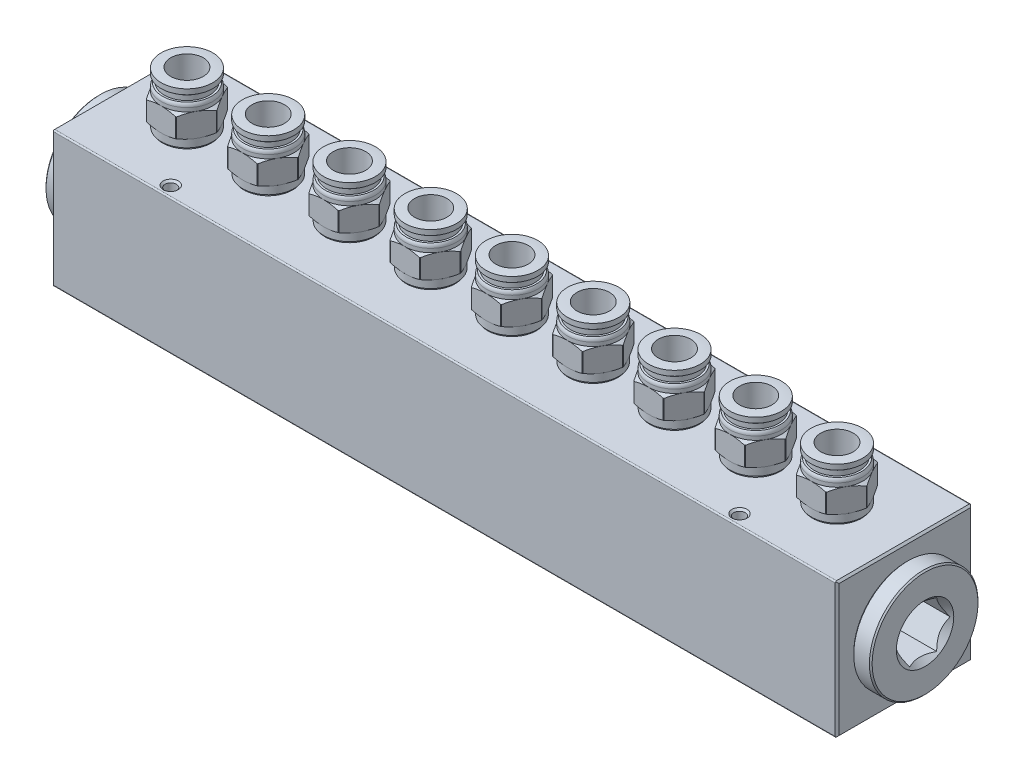
from build123d import *

# Parameters (mm, degrees)
SKETCH_1_W             = 50
SKETCH_1_H             = 50
SKETCH_1_R             = 16
EXTRUDE_1_DEPTH        = 145
SKETCH_2_R             = 7.6
CUT_EXTRUDE_1_DEPTH    = 20
SKETCH_3_R             = 2.1
CUT_EXTRUDE_2_DEPTH    = 156.402702773
CHAMFER_1_SIZE         = 0.7
FILLET_1_R             = 0.5
CUT_EXTRUDE_3_DEPTH    = 15.6
CHAMFER_2_SIZE         = 0.5
SKETCH_12_R            = 12
CUT_EXTRUDE_6_DEPTH    = 15
PATTERN_LINEAR_1_COUNT = 9
PATTERN_LINEAR_1_PITCH = 30


with BuildPart() as part:
    # 草圖1 → 填料-伸長1 (new, symmetric)
    with BuildSketch(Plane(origin=(0, 0, 0), x_dir=(0, 0, -1), z_dir=(1, 0, 0))):
        Rectangle(SKETCH_1_W, SKETCH_1_H)
        Circle(SKETCH_1_R, mode=Mode.SUBTRACT)
    extrude(amount=EXTRUDE_1_DEPTH, both=True)

    # 草圖2 → 除料-伸長1 (cut)
    with BuildSketch(Plane(origin=(0, 25, 0), x_dir=(1, 0, 0), z_dir=(0, 1, 0))):
        with Locations((120, 0)):
            Circle(SKETCH_2_R)
        with Locations((90, 0)):
            Circle(SKETCH_2_R)
        with Locations((60, 0)):
            Circle(SKETCH_2_R)
        with Locations((30, 0)):
            Circle(SKETCH_2_R)
        Circle(SKETCH_2_R)
        with Locations((-30, 0)):
            Circle(SKETCH_2_R)
        with Locations((-60, 0)):
            Circle(SKETCH_2_R)
        with Locations((-90, 0)):
            Circle(SKETCH_2_R)
        with Locations((-120, 0)):
            Circle(SKETCH_2_R)
    extrude(amount=-CUT_EXTRUDE_1_DEPTH, mode=Mode.SUBTRACT)

    # 草圖3 → 除料-伸長2 (cut, through all)
    with BuildSketch(Plane(origin=(0, 25, 0), x_dir=(1, 0, 0), z_dir=(0, 1, 0))):
        with Locations((105, 21)):
            Circle(SKETCH_3_R)
        with Locations((105, -21)):
            Circle(SKETCH_3_R)
        with Locations((-105, -21)):
            Circle(SKETCH_3_R)
        with Locations((-105, 21)):
            Circle(SKETCH_3_R)
    extrude(amount=-CUT_EXTRUDE_2_DEPTH, mode=Mode.SUBTRACT)

    # 導角1
    chamfer_1_edges = [part.edges().sort_by_distance(p)[0] for p in [
        (102.9, -25, -21),
        (102.9, -25, 21),
        (-107.1, -25, -21),
        (-107.1, -25, 21),
        (102.9, 25, -21),
        (102.9, 25, 21),
        (-107.1, 25, -21),
        (-107.1, 25, 21),
        (-145, 25, 0),
        (-145, 0, -25),
        (-145, -25, 0),
        (-145, 0, 25),
        (145, 0, -25),
        (145, -25, 0),
        (145, 0, 25),
        (145, 25, 0),
    ]]
    chamfer(chamfer_1_edges, length=CHAMFER_1_SIZE)

    # 圓角1
    fillet_1_edges = [part.edges().sort_by_distance(p)[0] for p in [
        (0, -25, -25),
        (0, -25, 25),
        (0, 25, -25),
        (0, 25, 25),
    ]]
    fillet(fillet_1_edges, radius=FILLET_1_R)


with BuildPart() as body_2:
    # 草圖4 → 旋轉1 (revolve)
    with BuildSketch(Plane(origin=(0, 0, 0), x_dir=(1, 0, 0), z_dir=(0, 1, 0))):
        Polygon((-133, 0), (-133, 16), (-145, 16), (-145, 18.55), (-145.7, 18.55), (-145.7, 20.05), (-152.5, 20.05), (-152.5, 10.6), (-148.5, 6.6), (-148.5, 0), align=None)
    revolve(axis=Axis((-123.427630141, 0, 0), (-1, 0, 0)))

    # 草圖5 → 除料-伸長3 (cut)
    with BuildSketch(Plane.ZY.offset(152.5)):
        Polygon((9.93042463, 0), (4.965212315, 8.6), (-4.965212315, 8.6), (-9.93042463, 0), (-4.965212315, -8.6), (4.965212315, -8.6), align=None)
    extrude(amount=-CUT_EXTRUDE_3_DEPTH, mode=Mode.SUBTRACT)

    # 導角2
    chamfer_2_edges = [body_2.edges().sort_by_distance(p)[0] for p in [
        (-145.7, 0, 20.05),
        (-152.5, 0, 20.05),
    ]]
    chamfer(chamfer_2_edges, length=CHAMFER_2_SIZE)


with BuildPart() as body_3:
    # 鏡射2: mirrored copy
    add(body_2.part.mirror(Plane(origin=(0, 0, 0), x_dir=(0, 0, 1), z_dir=(1, 0, 0))))


with BuildPart() as body_4:
    # 草圖11 → 旋轉4 (revolve)
    with BuildSketch(Plane.XY):
        with BuildLine():
            Line((127.6, 18.8), (127.6, 25))
            Line((127.6, 25), (129, 25))
            Line((129, 25), (129, 25.7))
            Line((129, 25.7), (129.5, 25.7))
            Line((129.5, 25.7), (129.5, 28.5))
            Line((129.5, 28.5), (130.95, 29.33715789))
            Line((130.95, 29.33715789), (130.95, 36.391709623))
            Line((130.95, 36.391709623), (129.55, 37.2))
            Line((129.55, 37.2), (129.55, 38.6))
            ThreePointArc((129.55, 38.6), (129.421249625, 39.343303437), (129.05, 40))
            Line((129.05, 40), (128.35, 40))
            Line((128.35, 40), (128.35, 41.8))
            Line((128.35, 41.8), (126.55, 41.8))
            Line((126.55, 41.8), (126.55, 42.7))
            Line((126.55, 42.7), (129.55, 42.7))
            Line((129.55, 42.7), (129.55, 44.6))
            ThreePointArc((129.55, 44.6), (127.77781467, 44.749960388), (126, 44.8))
            Line((126, 44.8), (126, 18.8))
            Line((126, 18.8), (127.6, 18.8))
        make_face()
    revolve(axis=Axis((120, 25, 0), (0, 1, 0)))

    # 草圖12 → 除料-伸長6 (cut)
    with BuildSketch(Plane(origin=(0, 25, 0), x_dir=(1, 0, 0), z_dir=(0, 1, 0))):
        with Locations((120, 0)):
            Circle(SKETCH_12_R)
        Polygon((131.027390142, 0), (125.513695071, 9.55), (114.486304929, 9.55), (108.972609858, 0), (114.486304929, -9.55), (125.513695071, -9.55), align=None, mode=Mode.SUBTRACT)
    extrude(amount=CUT_EXTRUDE_6_DEPTH, mode=Mode.SUBTRACT)


with BuildPart() as pattern_linear_1_1:
    # 直線複製排列1: pattern copy
    add(body_4.part.moved(Location(Vector(-1, 0, 0) * (1 * PATTERN_LINEAR_1_PITCH))))


with BuildPart() as pattern_linear_1_2:
    # 直線複製排列1: pattern copy
    add(body_4.part.moved(Location(Vector(-1, 0, 0) * (2 * PATTERN_LINEAR_1_PITCH))))


with BuildPart() as pattern_linear_1_3:
    # 直線複製排列1: pattern copy
    add(body_4.part.moved(Location(Vector(-1, 0, 0) * (3 * PATTERN_LINEAR_1_PITCH))))


with BuildPart() as pattern_linear_1_4:
    # 直線複製排列1: pattern copy
    add(body_4.part.moved(Location(Vector(-1, 0, 0) * (4 * PATTERN_LINEAR_1_PITCH))))


with BuildPart() as pattern_linear_1_5:
    # 直線複製排列1: pattern copy
    add(body_4.part.moved(Location(Vector(-1, 0, 0) * (5 * PATTERN_LINEAR_1_PITCH))))


with BuildPart() as pattern_linear_1_6:
    # 直線複製排列1: pattern copy
    add(body_4.part.moved(Location(Vector(-1, 0, 0) * (6 * PATTERN_LINEAR_1_PITCH))))


with BuildPart() as pattern_linear_1_7:
    # 直線複製排列1: pattern copy
    add(body_4.part.moved(Location(Vector(-1, 0, 0) * (7 * PATTERN_LINEAR_1_PITCH))))


with BuildPart() as pattern_linear_1_8:
    # 直線複製排列1: pattern copy
    add(body_4.part.moved(Location(Vector(-1, 0, 0) * (8 * PATTERN_LINEAR_1_PITCH))))


solid = Compound([part.part, body_2.part, body_3.part, body_4.part, pattern_linear_1_1.part, pattern_linear_1_2.part, pattern_linear_1_3.part, pattern_linear_1_4.part, pattern_linear_1_5.part, pattern_linear_1_6.part, pattern_linear_1_7.part, pattern_linear_1_8.part])
